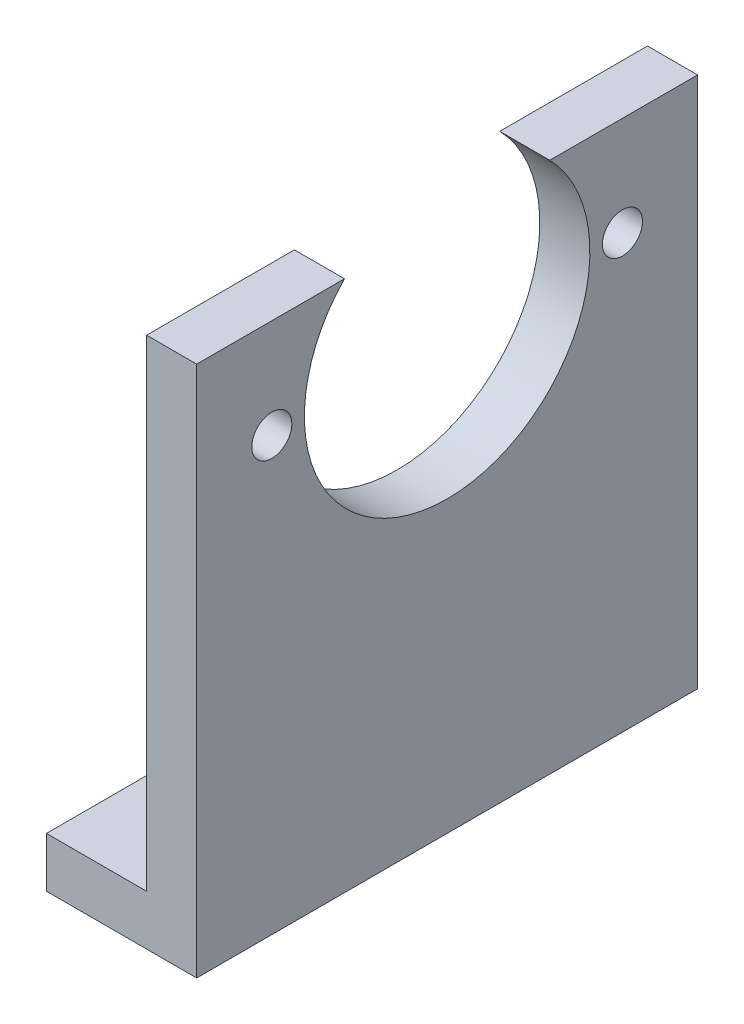
from build123d import *

# Parameters (mm, degrees)
SKETCH_2_R      = 2
EXTRUDE_2_DEPTH = 5
SKETCH_4_W      = 50
SKETCH_4_H      = 5
EXTRUDE_3_DEPTH = 10


with BuildPart() as part:
    # 草图2 → 凸台-拉伸2 (new body)
    with BuildSketch(Plane(origin=(0, 0, 0), x_dir=(0, 0, -1), z_dir=(1, 0, 0))):
        with BuildLine():
            Line((-25, 9.903100775), (-10.246516239, 9.903100775))
            ThreePointArc((-10.246516239, 9.903100775), (0, -14.25), (10.246516239, 9.903100775))
            Line((10.246516239, 9.903100775), (25, 9.903100775))
            Line((25, 9.903100775), (25, -43.166899225))
            Line((25, -43.166899225), (-25, -43.166899225))
            Line((-25, -43.166899225), (-25, 9.903100775))
        make_face()
        with Locations((17.5, 0)):
            Circle(SKETCH_2_R, mode=Mode.SUBTRACT)
        with Locations((-17.5, 0)):
            Circle(SKETCH_2_R, mode=Mode.SUBTRACT)
    extrude(amount=EXTRUDE_2_DEPTH)

    # 草图4 → 凸台-拉伸3 (add)
    with BuildSketch(Plane.ZY):
        with Locations((0, -40.666899225)):
            Rectangle(SKETCH_4_W, SKETCH_4_H)
    extrude(amount=EXTRUDE_3_DEPTH)


solid = part.part
